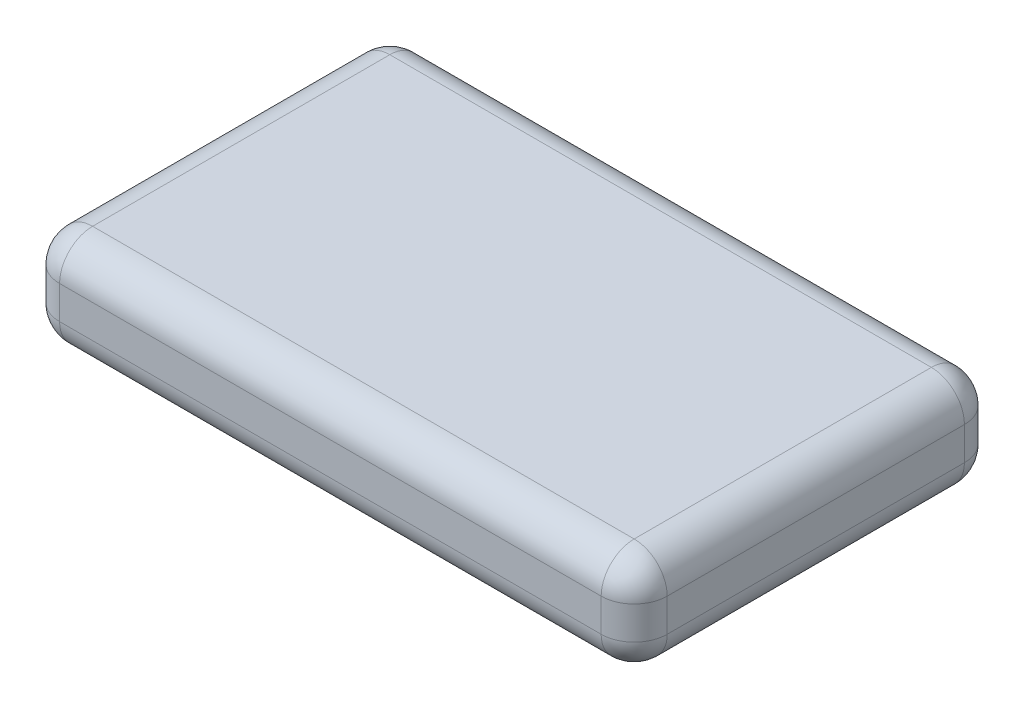
from build123d import *

# Parameters (mm, degrees)
SKETCH1_W           = 92
SKETCH1_H           = 55
BOSS_EXTRUDE1_DEPTH = 15
FILLET3_R           = 5


with BuildPart() as part:
    # Sketch1 → Boss-Extrude1 (new body)
    with BuildSketch(Plane(origin=(0, 0, 0), x_dir=(1, 0, 0), z_dir=(0, 1, 0))):
        with Locations((46, 27.5)):
            Rectangle(SKETCH1_W, SKETCH1_H)
    extrude(amount=BOSS_EXTRUDE1_DEPTH)

    # Fillet3
    fillet3_edges = [part.edges().sort_by_distance(p)[0] for p in [
        (92, 15, -27.5),
        (46, 15, -55),
        (0, 15, -27.5),
        (46, 0, -55),
        (92, 0, -27.5),
        (46, 0, 0),
        (0, 0, -27.5),
        (46, 15, 0),
        (0, 7.5, -55),
        (92, 7.5, -55),
        (92, 7.5, 0),
        (0, 7.5, 0),
    ]]
    fillet(fillet3_edges, radius=FILLET3_R)


solid = part.part
